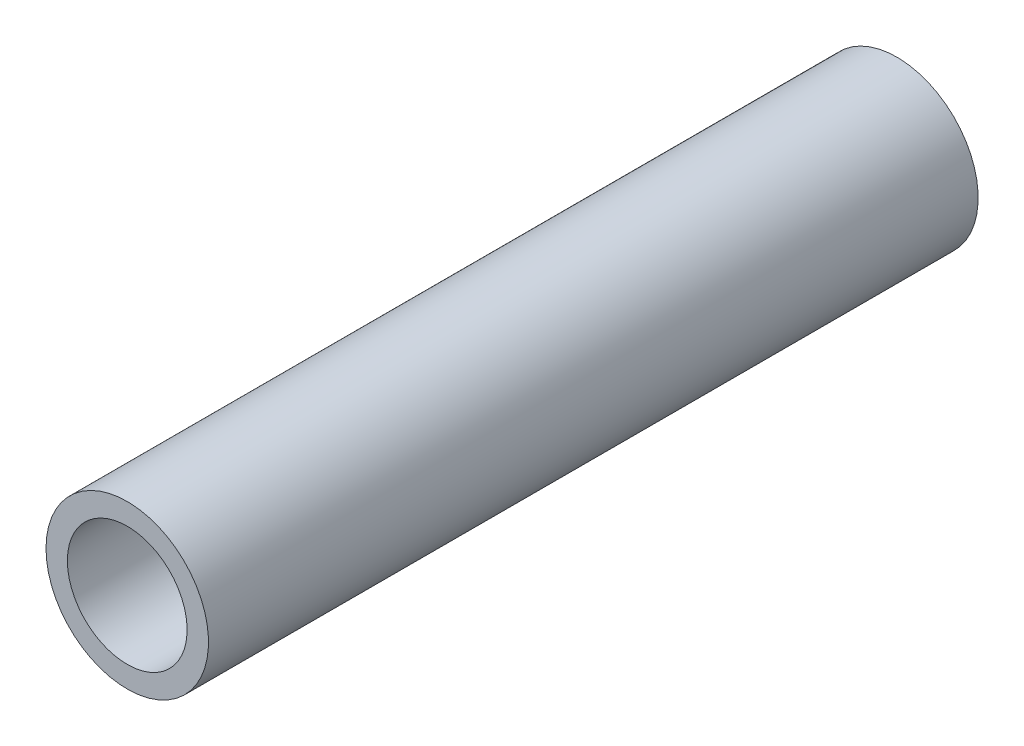
from build123d import *

# Parameters (mm, degrees)
SKETCH2_R           = 9.5
SKETCH2_R_2         = 7
BOSS_EXTRUDE2_DEPTH = 90


with BuildPart() as part:
    # Sketch2 → Boss-Extrude2 (new body)
    with BuildSketch(Plane.XY):
        with Locations(Location((0, 0, 0), (0, 0, 180))):
            Circle(SKETCH2_R)
        with Locations(Location((0, 0, 0), (0, 0, 180))):
            Circle(SKETCH2_R_2, mode=Mode.SUBTRACT)
    extrude(amount=BOSS_EXTRUDE2_DEPTH)


solid = part.part
